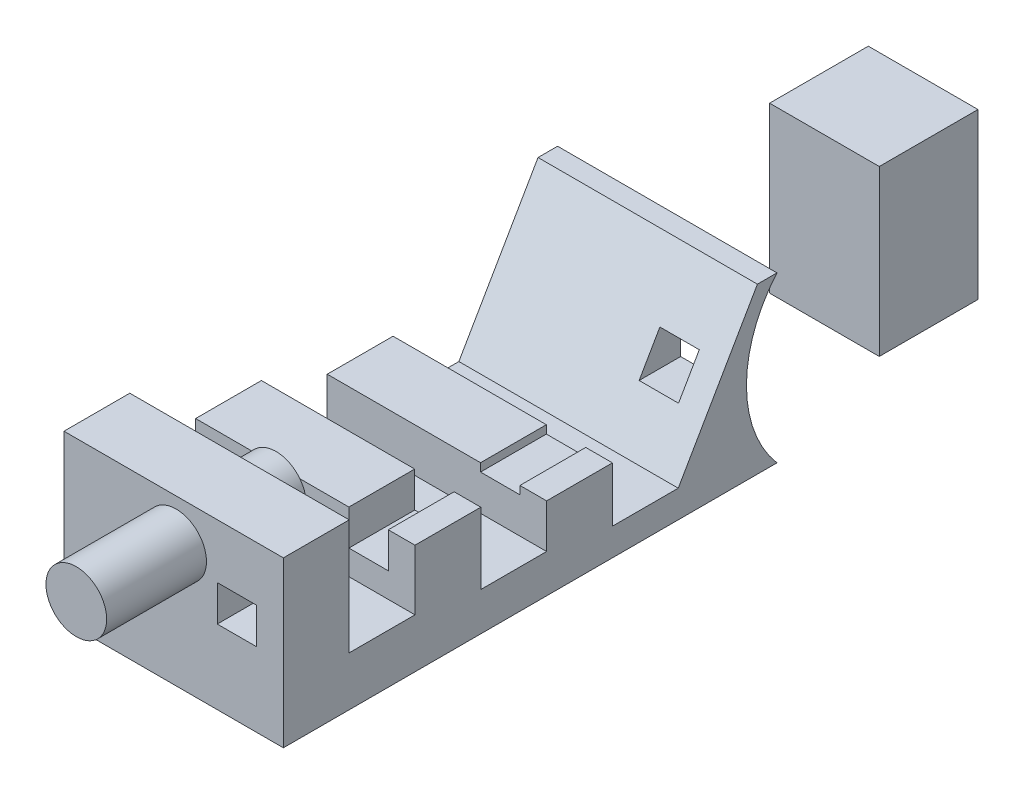
from build123d import *

# Parameters (mm, degrees)
BOSS_EXTRUDE1_DEPTH     = 100
SKETCH2_W               = 100
SKETCH2_H               = 90
BOSS_EXTRUDE2_DEPTH     = 150
SKETCH4_R               = 27.667400723
BOSS_EXTRUDE3_DEPTH     = 91
CUT_EXTRUDE1_REACH      = 696.438
CUT_EXTRUDE1_END_RADIUS = 115
SKETCH5_W               = 35.913352936
SKETCH5_H               = 32.77529297


with BuildPart() as part:
    # Sketch1 → Boss-Extrude1 (new, symmetric)
    with BuildSketch(Plane(origin=(0, 0, 0), x_dir=(0, 0, -1), z_dir=(1, 0, 0))):
        with BuildLine():
            Line((0, 0), (0, 150))
            Line((0, 150), (60, 150))
            Line((60, 150), (60, 45))
            Line((60, 45), (120, 45))
            Line((120, 45), (120, 100))
            Line((120, 100), (180, 100))
            Line((180, 100), (180, 35))
            Line((180, 35), (240, 35))
            Line((240, 35), (240, 75))
            Line((240, 75), (300, 75))
            Line((300, 75), (300, 25))
            Line((300, 25), (360, 25))
            Line((360, 25), (432.168783649, 150))
            Line((432.168783649, 150), (450, 150))
            ThreePointArc((450, 150), (422.177978871, 75), (450, 0))
            Line((450, 0), (0, 0))
        make_face()
    extrude(amount=BOSS_EXTRUDE1_DEPTH, both=True)

    # Sketch4 → Boss-Extrude3 (add, symmetric)
    with BuildSketch(Plane.XY):
        with Locations((2.217244457, 112.008003776)):
            Circle(SKETCH4_R)
    extrude(amount=BOSS_EXTRUDE3_DEPTH, both=True)

    # Cut-Extrude1: up to this cylinder (the profile starts outside it)
    cut_extrude1_end = Plane(origin=(57.705436, 75, -537.177978871), z_dir=(-1, 0, 0)) * Cylinder(CUT_EXTRUDE1_END_RADIUS, 1623.876, mode=Mode.PRIVATE)
    # Sketch5 → Cut-Extrude1 (cut, up to the surface)
    with BuildSketch(Plane.XY, mode=Mode.PRIVATE) as cut_extrude1_sk1:
        with Locations((57.705436028, 83.995649624)):
            Rectangle(SKETCH5_W, SKETCH5_H)
    cut_extrude1_tool1 = extrude(cut_extrude1_sk1.sketch, amount=-CUT_EXTRUDE1_REACH, mode=Mode.PRIVATE) - cut_extrude1_end
    add(cut_extrude1_tool1.solids().sort_by_distance((57.705436, 83.99565, 0))[0], mode=Mode.SUBTRACT)


with BuildPart() as body_2:
    # Sketch2 → Boss-Extrude2 (new body)
    with BuildSketch(Plane.XZ):
        with Locations((12.648758885, -625.62982313)):
            Rectangle(SKETCH2_W, SKETCH2_H)
    extrude(amount=-BOSS_EXTRUDE2_DEPTH)


solid = Compound([part.part, body_2.part])
